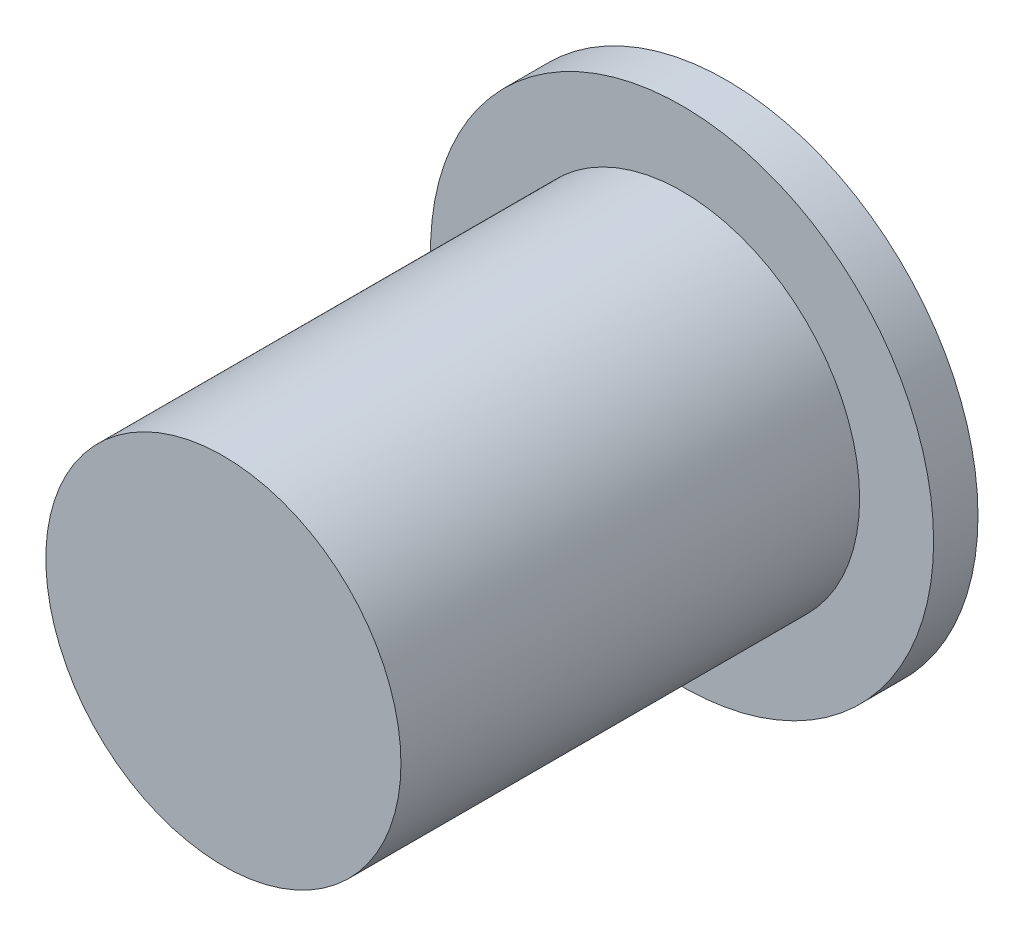
from build123d import *


with BuildPart() as part:
    # Sketch1 → Revolve1 (revolve)
    with BuildSketch(Plane(origin=(0, 0, 0), x_dir=(1, 0, 0), z_dir=(0, 1, 0))):
        Polygon((0, 0), (0, 34), (17, 34), (17, 31), (12, 31), (12, 0), align=None)
    revolve(axis=Axis((0, 0, 0), (0, 0, -1)))


solid = part.part
